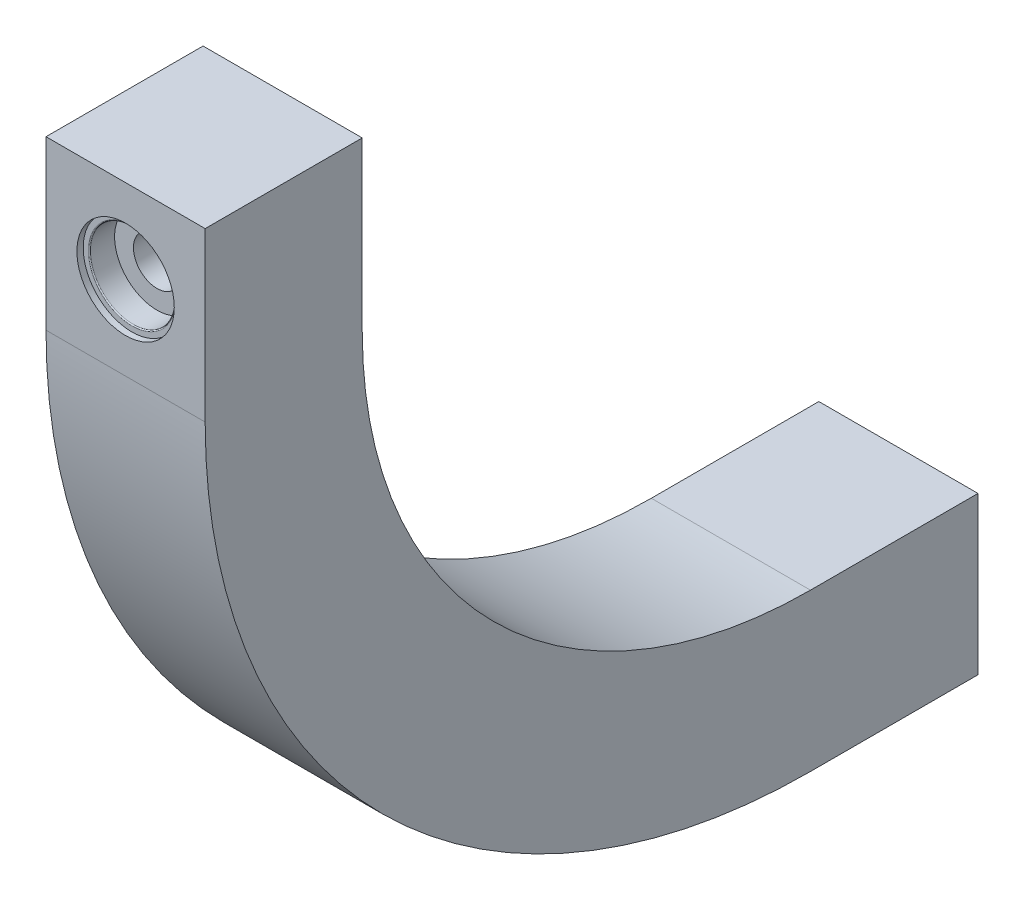
from build123d import *

# Parameters (mm, degrees)
BOSS_EXTRUDE1_DEPTH      = 7.6
BOSS_EXTRUDE1_DEPTH_BACK = 7.6
SKETCH7_R                = 2.25
CUT_EXTRUDE1_DEPTH       = 94.371547498
SKETCH15_R               = 2
CUT_EXTRUDE11_DEPTH      = 10


with BuildPart() as part:
    # Sketch5 → Boss-Extrude1 (new, two sides: drawn at the far end of the back side and taken through both)
    with BuildSketch(Plane(origin=(0, 0, 0), x_dir=(0, 0, -1), z_dir=(1, 0, 0)).offset(-BOSS_EXTRUDE1_DEPTH_BACK)):
        with BuildLine():
            Line((-50.80458146, 8), (-50.80458146, 0))
            Line((-50.80458146, 0), (-50.80458146, -8))
            ThreePointArc((-50.80458146, -8), (-38.267409816, -38.267409816), (-8, -50.80458146))
            Line((-8, -50.80458146), (0, -50.80458146))
            Line((0, -50.80458146), (8, -50.80458146))
            Line((8, -50.80458146), (8, -65.80458146))
            Line((8, -65.80458146), (-8, -65.80458146))
            ThreePointArc((-8, -65.80458146), (-48.874011534, -48.874011534), (-65.80458146, -8))
            Line((-65.80458146, -8), (-65.80458146, 8))
            Line((-65.80458146, 8), (-50.80458146, 8))
        make_face()
    extrude(amount=BOSS_EXTRUDE1_DEPTH + BOSS_EXTRUDE1_DEPTH_BACK)

    # Sketch7 → Cut-Extrude1 (cut, through all)
    with BuildSketch(Plane.XY):
        Circle(SKETCH7_R)
    extrude(amount=CUT_EXTRUDE1_DEPTH, mode=Mode.SUBTRACT)

    # Sketch15 → Cut-Extrude11 (cut)
    with BuildSketch(Plane.XZ.offset(65.80458146)):
        Circle(SKETCH15_R)
    extrude(amount=-CUT_EXTRUDE11_DEPTH, mode=Mode.SUBTRACT)

    # Sketch18 → Cut-Revolve1 (revolve, cut)
    with BuildSketch(Plane(origin=(0, 0, 0), x_dir=(0, 0, -1), z_dir=(1, 0, 0))):
        with BuildLine():
            Line((-65.80458146, 4.65), (-65.80458146, 0))
            Line((-65.80458146, 0), (-62.80458146, 0))
            Line((-62.80458146, 0), (-62.80458146, 4.05))
            Line((-62.80458146, 4.05), (-65.10458146, 4.05))
            ThreePointArc((-65.10458146, 4.05), (-65.175292138, 4.079289322), (-65.20458146, 4.15))
            Line((-65.20458146, 4.15), (-65.20458146, 4.65))
            Line((-65.20458146, 4.65), (-65.80458146, 4.65))
        make_face()
        with BuildLine():
            Line((-51.40458146, 4.65), (-50.80458146, 4.65))
            Line((-50.80458146, 4.65), (-50.80458146, 0))
            Line((-50.80458146, 0), (-53.80458146, 0))
            Line((-53.80458146, 0), (-53.80458146, 4.05))
            Line((-53.80458146, 4.05), (-51.50458146, 4.05))
            ThreePointArc((-51.50458146, 4.05), (-51.433870782, 4.079289322), (-51.40458146, 4.15))
            Line((-51.40458146, 4.15), (-51.40458146, 4.65))
        make_face()
    revolve(axis=Axis((0, 0, 109.558527697), (0, 0, -1)), mode=Mode.SUBTRACT)


solid = part.part
